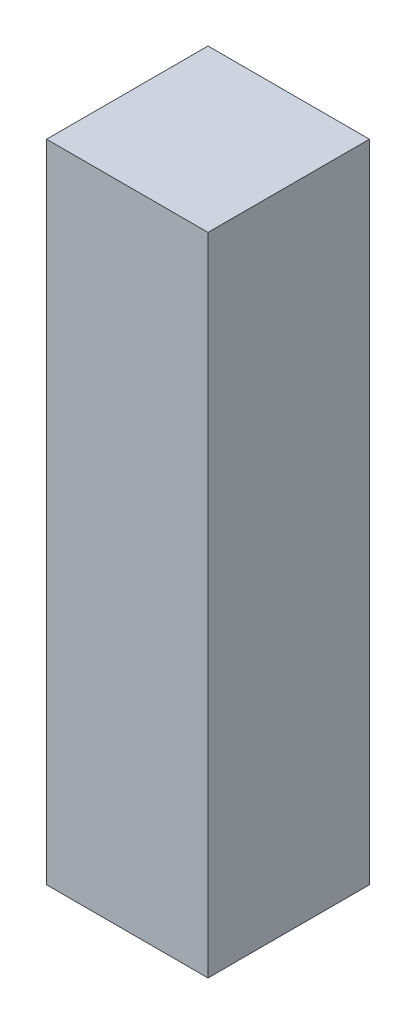
from build123d import *

# Parameters (mm, degrees)
SKETCH1_W           = 3.175
SKETCH1_H           = 3.175
BOSS_EXTRUDE1_DEPTH = 12.7


with BuildPart() as part:
    # Sketch1 → Boss-Extrude1 (new body)
    with BuildSketch(Plane(origin=(0, 0, 0), x_dir=(1, 0, 0), z_dir=(0, 1, 0))):
        Rectangle(SKETCH1_W, SKETCH1_H)
    extrude(amount=BOSS_EXTRUDE1_DEPTH)


solid = part.part
